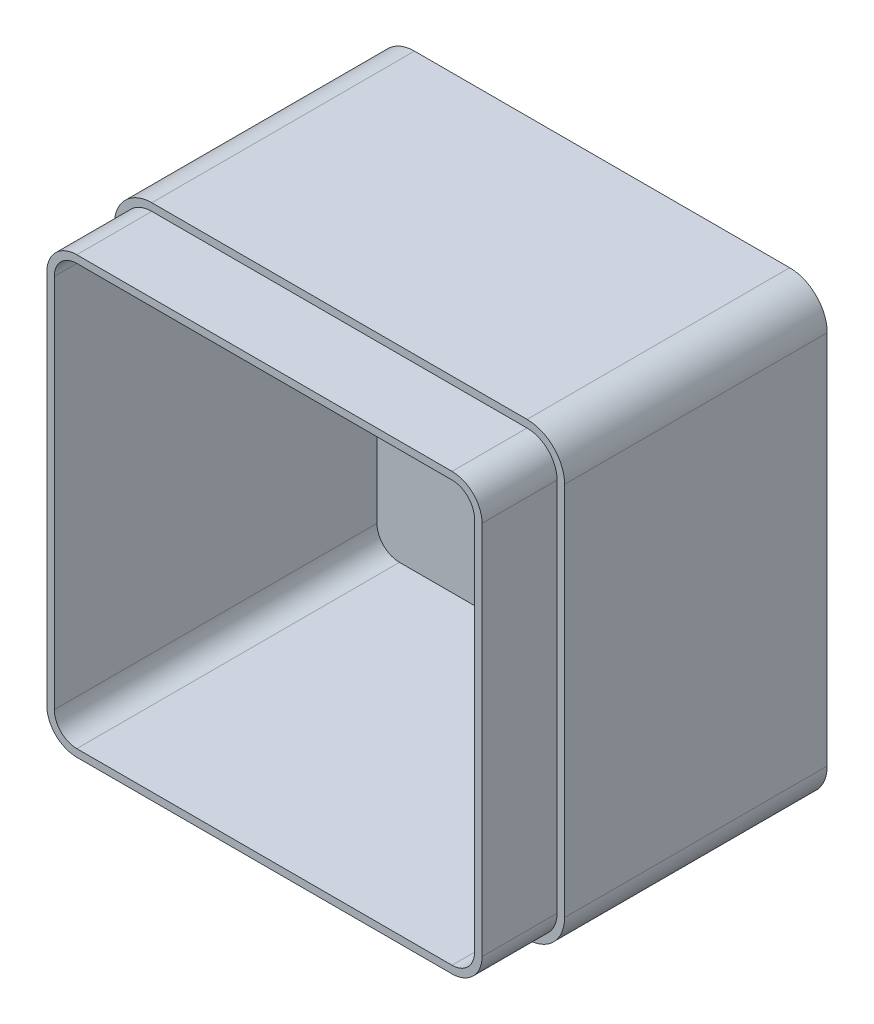
from build123d import *

# Parameters (mm, degrees)
SKETCH1_W           = 120
SKETCH1_H           = 120
BOSS_EXTRUDE1_DEPTH = 90
FILLET1_R           = 10
SHELL1_T            = -4
SKETCH2_OUTSIDE_W   = 160.418
SKETCH2_OUTSIDE_H   = 160.418
CUT_EXTRUDE1_DEPTH  = 20


with BuildPart() as part:
    # Sketch1 → Boss-Extrude1 (new body)
    with BuildSketch(Plane.XY):
        with Locations((60, 60)):
            Rectangle(SKETCH1_W, SKETCH1_H)
    extrude(amount=BOSS_EXTRUDE1_DEPTH)

    # Fillet1
    fillet1_edges = [part.edges().sort_by_distance(p)[0] for p in [
        (0, 120, 45),
        (120, 120, 45),
        (120, 0, 45),
        (0, 0, 45),
    ]]
    fillet(fillet1_edges, radius=FILLET1_R)

    # Shell1
    shell1_openings = [part.faces().sort_by_distance(p)[0] for p in [
        (60, 60, 90),
    ]]
    offset(amount=SHELL1_T, openings=shell1_openings, kind=Kind.INTERSECTION)

    # Sketch2 outside → Cut-Extrude1 (cut)
    with BuildSketch(Plane.XY.offset(90)):
        with Locations((60, 60)):
            Rectangle(SKETCH2_OUTSIDE_W, SKETCH2_OUTSIDE_H)
        with BuildLine():
            Line((2, 110), (2, 10))
            ThreePointArc((2, 10), (4.343145751, 4.343145751), (10, 2))
            Line((10, 2), (110, 2))
            ThreePointArc((110, 2), (115.656854249, 4.343145751), (118, 10))
            Line((118, 10), (118, 110))
            ThreePointArc((118, 110), (115.656854249, 115.656854249), (110, 118))
            Line((110, 118), (10, 118))
            ThreePointArc((10, 118), (4.343145751, 115.656854249), (2, 110))
        make_face(mode=Mode.SUBTRACT)
    extrude(amount=-CUT_EXTRUDE1_DEPTH, mode=Mode.SUBTRACT)


solid = part.part
